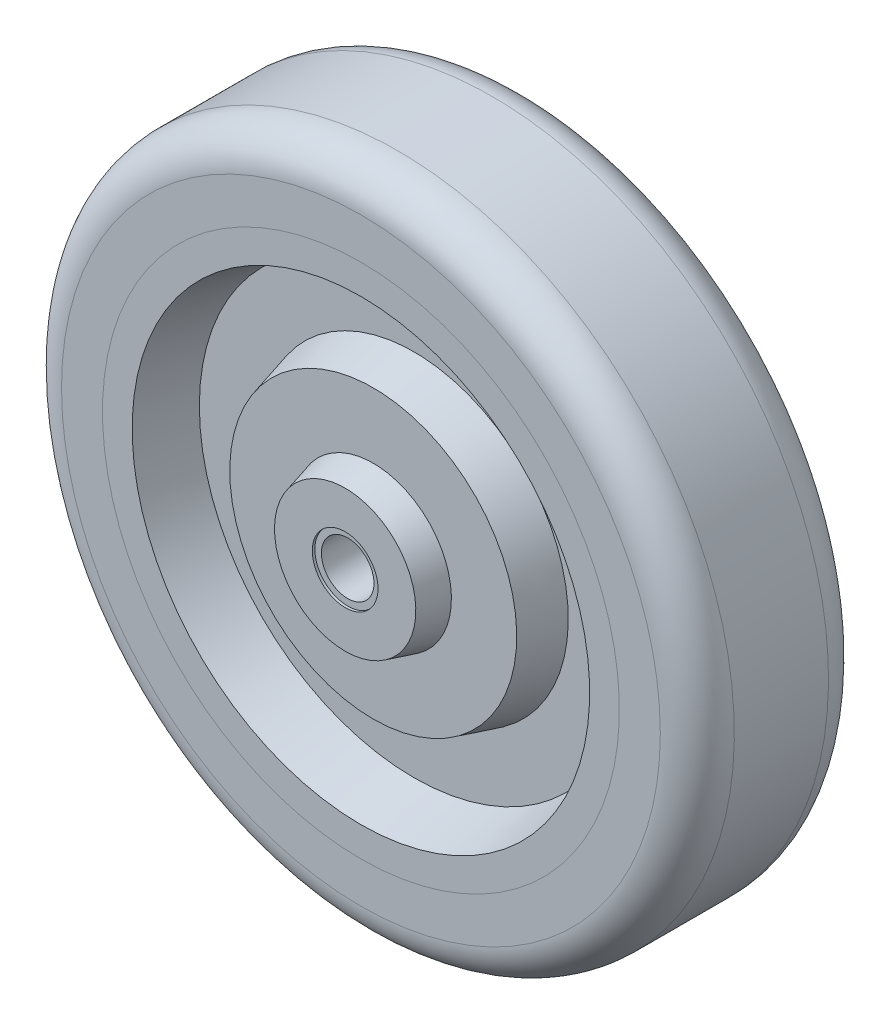
from build123d import *

# Parameters (mm, degrees)
SKETCH6_R          = 4.9609375
CUT_EXTRUDE1_DEPTH = 0.381


with BuildPart() as part:
    # Sketch3 → Revolve1 (revolve)
    with BuildSketch(Plane(origin=(0, 0, 0), x_dir=(0, 0, -1), z_dir=(1, 0, 0)), mode=Mode.PRIVATE) as revolve1_sk:
        with BuildLine():
            Line((7.112, 50.8), (-7.112, 50.8))
            ThreePointArc((-7.112, 50.8), (-11.063312693, 49.163312693), (-12.7, 45.212))
            Line((-12.7, 45.212), (-12.7, 39.0271))
            Line((-12.7, 39.0271), (0, 39.0271))
            Line((0, 39.0271), (12.7, 39.0271))
            Line((12.7, 39.0271), (12.7, 45.212))
            ThreePointArc((12.7, 45.212), (11.063312693, 49.163312693), (7.112, 50.8))
        make_face()
    revolve(revolve1_sk.sketch.rotate(Axis((0, 0, 15.08125), (0, 0, -1)), 180), axis=Axis((0, 0, 15.08125), (0, 0, -1)))


with BuildPart() as body_2:
    # Sketch4 → Revolve2 (revolve)
    with BuildSketch(Plane(origin=(0, 0, 0), x_dir=(0, 0, -1), z_dir=(1, 0, 0)), mode=Mode.PRIVATE) as revolve2_sk:
        Polygon((-12.7, 39.0271), (12.7, 39.0271), (12.7, 34.544), (4.699, 32.400138511), (4.699, 23.311528619), (10.83945, 21.6662), (10.83945, 11.804586884), (15.08125, 10.668), (15.08125, 3.96875), (-15.08125, 3.96875), (-15.08125, 10.668), (-10.83945, 11.804586884), (-10.83945, 21.6662), (-4.699, 23.311528619), (-4.699, 32.400138511), (-12.7, 34.544), align=None)
    revolve(revolve2_sk.sketch.rotate(Axis((0, 0, 15.08125), (0, 0, -1)), 180), axis=Axis((0, 0, 15.08125), (0, 0, -1)))

    # Sketch6 → Cut-Extrude1 (cut)
    with BuildSketch(Plane.XY.offset(15.08125)):
        Circle(SKETCH6_R)
    cut_extrude1 = extrude(amount=-CUT_EXTRUDE1_DEPTH, mode=Mode.SUBTRACT)

    # Mirror1: Cut-Extrude1 across plane
    add(cut_extrude1.mirror(Plane.XY), mode=Mode.SUBTRACT)


solid = Compound([part.part, body_2.part])
